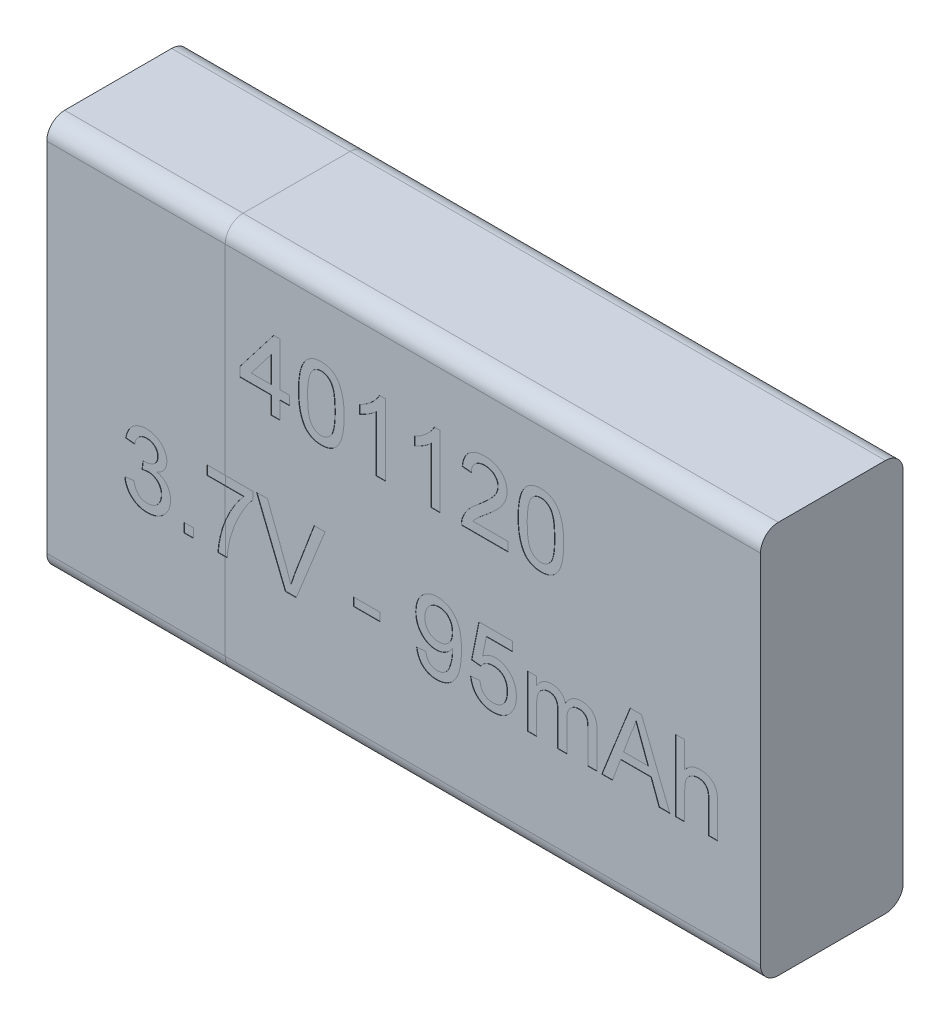
from build123d import *

# Parameters (mm, degrees)
SKETCH1_W           = 20
SKETCH1_H           = 11
BOSS_EXTRUDE1_DEPTH = 4
FILLET1_R           = 0.5
SKETCH5_W           = 0.256410257
SKETCH5_H           = 0.256410256
SKETCH5_W_2         = 0.743589744
SKETCH5_H_2         = 0.23076923
CUT_EXTRUDE1_DEPTH  = 0.01


with BuildPart() as part:
    # Sketch1 → Boss-Extrude1 (new body)
    with BuildSketch(Plane.XY):
        Rectangle(SKETCH1_W, SKETCH1_H)
    extrude(amount=BOSS_EXTRUDE1_DEPTH)

    # Fillet1
    fillet1_edges = [part.edges().sort_by_distance(p)[0] for p in [
        (0, 5.5, 4),
        (0, 5.5, 0),
        (0, -5.5, 0),
        (0, -5.5, 4),
    ]]
    fillet(fillet1_edges, radius=FILLET1_R)


with BuildPart() as body_2:
    # Split1: the piece on the far side of the plane
    add(part.part)
    split(bisect_by=Plane(origin=(-5, 0, 0), x_dir=(0, -1, 0), z_dir=(-1, 0, 0)), keep=Keep.BOTTOM)


with BuildPart() as part_1:
    add(part.part)

    # Split1
    split(bisect_by=Plane(origin=(-5, 0, 0), x_dir=(0, -1, 0), z_dir=(-1, 0, 0)), keep=Keep.TOP)


with BuildPart() as cut_extrude1_tool:
    # Sketch5 → Cut-Extrude1 (new body)
    # profile 1 of 16: a face of its own
    with BuildSketch(Plane.XY.offset(4)):
        Polygon((-3.717948718, 1.492817936), (-3.717948718, 1.979997423), (-4.58974359, 1.979997423), (-4.58974359, 2.236407679), (-3.641025641, 3.46717691), (-3.461538462, 3.46717691), (-3.461538462, 2.236407679), (-3.205128205, 2.236407679), (-3.205128205, 1.979997423), (-3.461538462, 1.979997423), (-3.461538462, 1.492817936), align=None)
        Polygon((-3.717948718, 2.236407679), (-3.717948718, 2.956760243), (-4.273237179, 2.236407679), align=None, mode=Mode.SUBTRACT)
    # profile 2 of 16: a face of its own
    with BuildSketch(Plane.XY.offset(4)):
        with BuildLine():
            add(Edge.make_bspline(
                [(-2.948717949, 2.479196141), (-2.948459615, 2.507777977), (-2.947953649, 2.563757757), (-2.944815304, 2.645666232), (-2.939336009, 2.723451319), (-2.931156929, 2.797045466), (-2.921471366, 2.866614788), (-2.908880073, 2.932060004), (-2.894713038, 2.99352795), (-2.877715138, 3.050954555), (-2.859040011, 3.104833585), (-2.837852483, 3.155078605), (-2.81401364, 3.201636343), (-2.788695013, 3.24498963), (-2.760563778, 3.284464143), (-2.731317878, 3.321167698), (-2.698831898, 3.353754234), (-2.664456674, 3.383062204), (-2.627686021, 3.408924779), (-2.588714493, 3.431241062), (-2.547692042, 3.450944732), (-2.503836825, 3.465777648), (-2.458059268, 3.47786962), (-2.410007, 3.486764621), (-2.359627067, 3.492008524), (-2.325199464, 3.492545084), (-2.307692308, 3.492817936)],
                knots=[0, 0, 0, 0, 1.514747001, 2.966751498, 4.343369068, 5.64627492, 6.890416844, 8.064737671, 9.177176366, 10.232018008, 11.237056675, 12.19799043, 13.119080079, 14.007588942, 14.855863561, 15.685992447, 16.491747269, 17.290132607, 18.077525251, 18.870243746, 19.668095604, 20.485086593, 21.319398728, 22.175900658, 23.072407314, 24, 24, 24, 24], degree=3))
            add(Edge.make_bspline(
                [(-2.307692308, 3.492817936), (-2.282007032, 3.492062807), (-2.231547278, 3.490579326), (-2.157875777, 3.478480324), (-2.088445136, 3.457783115), (-2.023300462, 3.429861689), (-1.963555395, 3.394396103), (-1.910200532, 3.35128228), (-1.863811391, 3.300972907), (-1.824894238, 3.242871834), (-1.790876762, 3.178581876), (-1.760656383, 3.107814477), (-1.733338039, 3.030648939), (-1.713952346, 2.961575011), (-1.700124548, 2.901947944), (-1.690971644, 2.852769227), (-1.683372899, 2.799705114), (-1.677551233, 2.742883982), (-1.672774694, 2.68236956), (-1.669085992, 2.618124172), (-1.667213597, 2.549987247), (-1.666852395, 2.503235545), (-1.666666667, 2.479196141)],
                knots=[0, 0, 0, 0, 1.134486744, 2.228744715, 3.287356444, 4.328707449, 5.352829806, 6.347195599, 7.349461267, 8.364207941, 9.428085653, 10.559314403, 11.761222316, 13.04268526, 13.726896727, 14.465273606, 15.252205015, 16.094778733, 16.988606776, 17.934225168, 18.937792761, 20, 20, 20, 20], degree=3))
            add(Edge.make_bspline(
                [(-1.666666667, 2.479196141), (-1.666929839, 2.450748558), (-1.667443998, 2.395170606), (-1.670498249, 2.313918899), (-1.676307711, 2.236720662), (-1.68345636, 2.163399057), (-1.694270768, 2.094149819), (-1.705923878, 2.028678724), (-1.720335897, 1.96728307), (-1.73715134, 1.909935949), (-1.756089347, 1.85633413), (-1.776857802, 1.806072519), (-1.799860861, 1.759185462), (-1.82578318, 1.71613027), (-1.853438697, 1.67633546), (-1.883029958, 1.63965175), (-1.915184334, 1.606607127), (-1.949869333, 1.577387065), (-1.986381809, 1.551065853), (-2.025448084, 1.528529241), (-2.06689717, 1.509858049), (-2.11045213, 1.493895107), (-2.156554892, 1.4821984), (-2.204841893, 1.473244754), (-2.255491049, 1.467972198), (-2.290051814, 1.467445664), (-2.307692308, 1.46717691)],
                knots=[0, 0, 0, 0, 1.508974709, 2.94807912, 4.311757619, 5.615040294, 6.854280449, 8.028314546, 9.141715822, 10.197470207, 11.196696834, 12.155719058, 13.080757287, 13.963948316, 14.818758719, 15.649605906, 16.461113142, 17.260189315, 18.052359509, 18.845763934, 19.647754795, 20.461145776, 21.303032214, 22.167241874, 23.064524267, 24, 24, 24, 24], degree=3))
            add(Edge.make_bspline(
                [(-2.307692308, 1.46717691), (-2.33082104, 1.467836658), (-2.375915702, 1.469122986), (-2.44177313, 1.47786279), (-2.503583839, 1.493245255), (-2.561869168, 1.51387531), (-2.615973972, 1.541469196), (-2.666156581, 1.575042546), (-2.713425378, 1.613814242), (-2.740636171, 1.64440422), (-2.754407051, 1.659885243)],
                knots=[0, 0, 0, 0, 1.10322584, 2.150986741, 3.161425019, 4.136713905, 5.093944212, 6.049774532, 7.013026876, 8, 8, 8, 8], degree=3))
            add(Edge.make_bspline(
                [(-2.754407051, 1.659885243), (-2.770257651, 1.682749967), (-2.802942267, 1.729898004), (-2.841196776, 1.810289782), (-2.875320475, 1.898789843), (-2.902101323, 1.997134546), (-2.923077402, 2.10454118), (-2.938227369, 2.221220499), (-2.946800758, 2.347122094), (-2.948064459, 2.434177627), (-2.948717949, 2.479196141)],
                knots=[0, 0, 0, 0, 0.779365345, 1.607084704, 2.489375761, 3.438383567, 4.461919411, 5.557722155, 6.737039282, 8, 8, 8, 8], degree=3))
        make_face()
        with BuildLine():
            add(Edge.make_bspline(
                [(-2.692307692, 2.479997423), (-2.692053097, 2.441530149), (-2.691565746, 2.367895277), (-2.68647411, 2.262695158), (-2.677709067, 2.167790291), (-2.666121109, 2.083312078), (-2.650820312, 2.009146245), (-2.631608351, 1.945481789), (-2.609951902, 1.891554594), (-2.583152457, 1.848033044), (-2.553810024, 1.812556632), (-2.523515968, 1.782045771), (-2.491557574, 1.756112237), (-2.458143366, 1.734488959), (-2.422754899, 1.718117233), (-2.38577914, 1.70625097), (-2.347208044, 1.699422118), (-2.320939374, 1.69844094), (-2.307692308, 1.697946141)],
                knots=[0, 0, 0, 0, 1.89448813, 3.626469325, 5.185477471, 6.587276848, 7.82441448, 8.910550357, 9.859733512, 10.6775885, 11.416198291, 12.123144072, 12.791880183, 13.439617036, 14.078171869, 14.70637855, 15.347637704, 16, 16, 16, 16], degree=3))
            add(Edge.make_bspline(
                [(-2.307692308, 1.697946141), (-2.294448558, 1.698451752), (-2.268186467, 1.699454368), (-2.229526248, 1.706132638), (-2.192694354, 1.718609768), (-2.157358651, 1.734923669), (-2.123701579, 1.756054088), (-2.091900141, 1.782085578), (-2.061446502, 1.812578323), (-2.032235875, 1.848467084), (-2.005640604, 1.892189848), (-1.983577907, 1.946073114), (-1.964665354, 2.009849065), (-1.949280599, 2.083977111), (-1.937644838, 2.168321758), (-1.92893279, 2.262963402), (-1.923807079, 2.368028162), (-1.923327771, 2.441529975), (-1.923076923, 2.479997423)],
                knots=[0, 0, 0, 0, 0.652509534, 1.29391342, 1.924290653, 2.562989607, 3.207355802, 3.876242846, 4.583348185, 5.32723334, 6.150888545, 7.094226006, 8.186903555, 9.424320409, 10.81992305, 12.379283064, 14.105084285, 16, 16, 16, 16], degree=3))
            add(Edge.make_bspline(
                [(-1.923076923, 2.479997423), (-1.923319739, 2.517664488), (-1.923784965, 2.589833159), (-1.929042875, 2.693006595), (-1.937282493, 2.786318522), (-1.94855298, 2.869854966), (-1.963531456, 2.943525237), (-1.981698305, 3.007486167), (-2.003346821, 3.061601352), (-2.029086829, 3.106414377), (-2.057740608, 3.143173215), (-2.087672197, 3.174991188), (-2.119629888, 3.202051337), (-2.154179876, 3.223759388), (-2.190208549, 3.241272636), (-2.228543754, 3.2533257), (-2.268808688, 3.260730725), (-2.296441989, 3.261604359), (-2.310496795, 3.262048705)],
                knots=[0, 0, 0, 0, 1.850066095, 3.544656626, 5.0727657, 6.45041401, 7.682899467, 8.762389858, 9.712573485, 10.538438529, 11.291566246, 11.996865408, 12.681389046, 13.341983376, 13.996294293, 14.643563182, 15.31009126, 16, 16, 16, 16], degree=3))
            add(Edge.make_bspline(
                [(-2.310496795, 3.262048705), (-2.323743029, 3.261701044), (-2.349862907, 3.2610155), (-2.388105828, 3.254471993), (-2.424348195, 3.24352979), (-2.459005228, 3.228707513), (-2.491211733, 3.208759657), (-2.52224494, 3.185469115), (-2.550651374, 3.157092189), (-2.567768842, 3.135878043), (-2.576522436, 3.125029474)],
                knots=[0, 0, 0, 0, 1.021318143, 2.013908504, 2.982026795, 3.937174072, 4.91255697, 5.897578595, 6.924855925, 8, 8, 8, 8], degree=3))
            add(Edge.make_bspline(
                [(-2.576522436, 3.125029474), (-2.58605243, 3.109096287), (-2.60617777, 3.075448749), (-2.628696855, 3.016967942), (-2.648589325, 2.950135512), (-2.664967423, 2.873923192), (-2.676815828, 2.788461717), (-2.686169685, 2.693850336), (-2.691028666, 2.589956958), (-2.691869587, 2.517661874), (-2.692307692, 2.479997423)],
                knots=[0, 0, 0, 0, 0.671104906, 1.417232262, 2.260109084, 3.195198885, 4.23592645, 5.382417421, 6.636286093, 8, 8, 8, 8], degree=3))
        make_face(mode=Mode.SUBTRACT)
    # profile 3 of 16: a face of its own
    with BuildSketch(Plane.XY.offset(4)):
        with BuildLine():
            Line((-0.512820513, 1.492817936), (-0.769230769, 1.492817936))
            Line((-0.769230769, 1.492817936), (-0.769230769, 3.051311526))
            add(Edge.make_bspline(
                [(-0.769230769, 3.051311526), (-0.783994894, 3.037073343), (-0.814680511, 3.007480842), (-0.866551304, 2.965600062), (-0.924445737, 2.923152117), (-0.987612016, 2.882333672), (-1.051999351, 2.843907509), (-1.114221421, 2.809349082), (-1.173239402, 2.780104268), (-1.212114865, 2.764113088), (-1.230769231, 2.756439731)],
                knots=[0, 0, 0, 0, 0.893362401, 1.856755847, 2.901947673, 4.020460078, 5.132200827, 6.168787962, 7.121294059, 8, 8, 8, 8], degree=3))
            Line((-1.230769231, 2.756439731), (-1.230769231, 2.992817936))
            add(Edge.make_bspline(
                [(-1.230769231, 2.992817936), (-1.198728429, 3.009319013), (-1.135577906, 3.041841659), (-1.046359873, 3.098012739), (-0.963065241, 3.158904502), (-0.887072868, 3.224503467), (-0.818950547, 3.291557385), (-0.761542878, 3.359217421), (-0.713507794, 3.425003453), (-0.689407682, 3.470881914), (-0.677884615, 3.492817936)],
                knots=[0, 0, 0, 0, 1.141258006, 2.249351951, 3.335817539, 4.406819942, 5.426913362, 6.360259544, 7.215985427, 8, 8, 8, 8], degree=3))
            Line((-0.677884615, 3.492817936), (-0.512820513, 3.492817936))
            Line((-0.512820513, 3.492817936), (-0.512820513, 1.492817936))
        make_face()
    # profile 4 of 16: a face of its own
    with BuildSketch(Plane.XY.offset(4)):
        with BuildLine():
            Line((1.025641026, 1.492817936), (0.769230769, 1.492817936))
            Line((0.769230769, 1.492817936), (0.769230769, 3.051311526))
            add(Edge.make_bspline(
                [(0.769230769, 3.051311526), (0.754466644, 3.037073343), (0.723781028, 3.007480842), (0.671910235, 2.965600062), (0.614015801, 2.923152117), (0.550849523, 2.882333672), (0.486462187, 2.843907509), (0.424240117, 2.809349082), (0.365222137, 2.780104268), (0.326346674, 2.764113088), (0.307692308, 2.756439731)],
                knots=[0, 0, 0, 0, 0.893362401, 1.856755847, 2.901947673, 4.020460078, 5.132200827, 6.168787962, 7.121294059, 8, 8, 8, 8], degree=3))
            Line((0.307692308, 2.756439731), (0.307692308, 2.992817936))
            add(Edge.make_bspline(
                [(0.307692308, 2.992817936), (0.339733109, 3.009319013), (0.402883632, 3.041841659), (0.492101666, 3.098012739), (0.575396297, 3.158904502), (0.651388671, 3.224503467), (0.719510992, 3.291557385), (0.77691866, 3.359217421), (0.824953745, 3.425003453), (0.849053856, 3.470881914), (0.860576923, 3.492817936)],
                knots=[0, 0, 0, 0, 1.141258006, 2.249351951, 3.335817539, 4.406819942, 5.426913362, 6.360259544, 7.215985427, 8, 8, 8, 8], degree=3))
            Line((0.860576923, 3.492817936), (1.025641026, 3.492817936))
            Line((1.025641026, 3.492817936), (1.025641026, 1.492817936))
        make_face()
    # profile 5 of 16: a face of its own
    with BuildSketch(Plane.XY.offset(4)):
        with BuildLine():
            Line((2.923076923, 1.749228192), (2.923076923, 1.492817936))
            Line((2.923076923, 1.492817936), (1.615384615, 1.492817936))
            add(Edge.make_bspline(
                [(1.615384615, 1.492817936), (1.615357843, 1.508057118), (1.615304389, 1.538484405), (1.620453176, 1.583484431), (1.628517208, 1.627887495), (1.637635205, 1.656361413), (1.642227564, 1.670702551)],
                knots=[0, 0, 0, 0, 1.01057331, 2.01775941, 3.001627217, 4, 4, 4, 4], degree=3))
            add(Edge.make_bspline(
                [(1.642227564, 1.670702551), (1.650712716, 1.694134259), (1.667989882, 1.741845076), (1.702993601, 1.810685122), (1.744166247, 1.879108838), (1.784253613, 1.934815402), (1.820964984, 1.979321053), (1.851752254, 2.014141573), (1.885870193, 2.04978448), (1.923291478, 2.086243261), (1.963655951, 2.123754046), (2.00701869, 2.162441932), (2.05389174, 2.201585927), (2.086614034, 2.227532195), (2.103365385, 2.240814731)],
                knots=[0, 0, 0, 0, 1.204657718, 2.452881516, 3.728232997, 5.065887527, 5.768225529, 6.518857853, 7.313994055, 8.154655305, 9.046094665, 9.979688118, 10.965752482, 12, 12, 12, 12], degree=3))
            add(Edge.make_bspline(
                [(2.103365385, 2.240814731), (2.129099596, 2.262474799), (2.178652453, 2.304182634), (2.248628853, 2.366073196), (2.312540903, 2.423542089), (2.369370878, 2.477596572), (2.419583586, 2.527712351), (2.463296929, 2.573775884), (2.500887029, 2.615643414), (2.531894985, 2.65483037), (2.558057348, 2.691833755), (2.580227641, 2.727928273), (2.598703638, 2.763744415), (2.614091672, 2.799168849), (2.626262299, 2.834353066), (2.634558312, 2.869399573), (2.640184382, 2.903960624), (2.640747274, 2.926957931), (2.641025641, 2.938330756)],
                knots=[0, 0, 0, 0, 1.782554561, 3.432421876, 4.950675607, 6.337395053, 7.588547463, 8.709982106, 9.702713005, 10.569305638, 11.356701089, 12.103210377, 12.812277205, 13.490692607, 14.148717897, 14.782152033, 15.397739362, 16, 16, 16, 16], degree=3))
            add(Edge.make_bspline(
                [(2.641025641, 2.938330756), (2.640747241, 2.949570887), (2.640201035, 2.971623411), (2.635018662, 3.003897142), (2.627804382, 3.034977517), (2.616141088, 3.06430502), (2.602258256, 3.092748152), (2.584450174, 3.119408147), (2.563849884, 3.14494944), (2.540264295, 3.168698628), (2.514503309, 3.190979157), (2.485719078, 3.20949969), (2.455802143, 3.226173688), (2.423720394, 3.239580538), (2.389525963, 3.249425428), (2.353467769, 3.256570282), (2.315551534, 3.261100503), (2.289676369, 3.261727846), (2.276442308, 3.262048705)],
                knots=[0, 0, 0, 0, 0.988194508, 1.938783882, 2.870742509, 3.789494954, 4.709148727, 5.651055405, 6.603531303, 7.592354411, 8.592907906, 9.593461401, 10.59787167, 11.603930315, 12.645063138, 13.723588815, 14.835711238, 16, 16, 16, 16], degree=3))
            add(Edge.make_bspline(
                [(2.276442308, 3.262048705), (2.262540295, 3.261729435), (2.235333034, 3.261104599), (2.195563304, 3.256556311), (2.15780884, 3.249607142), (2.122159754, 3.238982457), (2.088659437, 3.225597963), (2.057444328, 3.20875045), (2.028014543, 3.189732655), (2.001296939, 3.16721702), (1.97713656, 3.142251773), (1.955687768, 3.115072172), (1.938113706, 3.085153706), (1.923600321, 3.053154214), (1.911930345, 3.018973104), (1.903458338, 2.982349067), (1.898839344, 2.943387849), (1.897910503, 2.916707218), (1.897435897, 2.903074346)],
                knots=[0, 0, 0, 0, 1.131143733, 2.213731411, 3.253917892, 4.251203413, 5.236093891, 6.184197493, 7.13373276, 8.082770301, 9.020476205, 9.957489029, 10.893177274, 11.836722509, 12.812818608, 13.827831385, 14.890097571, 16, 16, 16, 16], degree=3))
            Line((1.897435897, 2.903074346), (1.641025641, 2.928715372))
            add(Edge.make_bspline(
                [(1.641025641, 2.928715372), (1.643649082, 2.951062152), (1.648752761, 2.99453589), (1.661465329, 3.057500276), (1.679312625, 3.116075204), (1.70066842, 3.171077331), (1.727439921, 3.221570356), (1.757702799, 3.268598669), (1.793396467, 3.31067073), (1.8328285, 3.34911271), (1.876430919, 3.38299021), (1.923794148, 3.41258691), (1.97489652, 3.437342722), (2.029453414, 3.457839502), (2.087590078, 3.473390925), (2.149224268, 3.484542762), (2.214455103, 3.491416883), (2.259197728, 3.492344254), (2.282051282, 3.492817936)],
                knots=[0, 0, 0, 0, 1.130804643, 2.199883102, 3.223565206, 4.205909148, 5.160801384, 6.091796021, 7.01151579, 7.927798993, 8.855738875, 9.7815393, 10.730299821, 11.705391175, 12.706931101, 13.751121791, 14.851322166, 16, 16, 16, 16], degree=3))
            add(Edge.make_bspline(
                [(2.282051282, 3.492817936), (2.305178381, 3.49242191), (2.350230106, 3.491650451), (2.41587771, 3.483756869), (2.477818039, 3.471462688), (2.536278164, 3.454328363), (2.590912695, 3.431860153), (2.641763658, 3.404409075), (2.689065517, 3.372242905), (2.732027954, 3.334975509), (2.770768307, 3.294291903), (2.804718513, 3.250873726), (2.83310252, 3.204906461), (2.85726974, 3.157016672), (2.875195459, 3.10619248), (2.887801155, 3.053124851), (2.896367091, 2.997768434), (2.897074892, 2.959998625), (2.897435897, 2.940734602)],
                knots=[0, 0, 0, 0, 1.195390245, 2.328627238, 3.413424916, 4.457841177, 5.473507151, 6.462241215, 7.441013641, 8.425227782, 9.397253344, 10.342087291, 11.269524934, 12.186751184, 13.110685745, 14.048630397, 15.004728144, 16, 16, 16, 16], degree=3))
            add(Edge.make_bspline(
                [(2.897435897, 2.940734602), (2.896884648, 2.920943002), (2.895780933, 2.881316124), (2.88716629, 2.822085629), (2.872426541, 2.763497916), (2.852885566, 2.704839938), (2.826188529, 2.645878884), (2.792461355, 2.585801385), (2.75061911, 2.52438552), (2.710378602, 2.472175211), (2.67292122, 2.428409806), (2.639718791, 2.392388321), (2.601305502, 2.354117902), (2.559122379, 2.312273155), (2.511448993, 2.268339239), (2.45965511, 2.221000527), (2.402606937, 2.171502794), (2.363004387, 2.137688319), (2.342548077, 2.120221782)],
                knots=[0, 0, 0, 0, 0.927118007, 1.856282007, 2.79721255, 3.754929441, 4.749232485, 5.824981375, 6.979078785, 8.228161913, 8.911614355, 9.677694854, 10.522803217, 11.452009355, 12.461436787, 13.560019032, 14.739651695, 16, 16, 16, 16], degree=3))
            add(Edge.make_bspline(
                [(2.342548077, 2.120221782), (2.325030337, 2.105960474), (2.291626704, 2.078766356), (2.244103565, 2.039342315), (2.201537287, 2.003191537), (2.162932464, 1.971493192), (2.129695059, 1.942714072), (2.10065433, 1.918114576), (2.076865344, 1.89645785), (2.04063893, 1.863560847), (1.994755086, 1.816669494), (1.960945906, 1.771106476), (1.944711538, 1.749228192)],
                knots=[0, 0, 0, 0, 1.241996727, 2.368296581, 3.394949853, 4.3125351, 5.114548721, 5.812230366, 6.404953749, 6.883082049, 8.503329734, 10, 10, 10, 10], degree=3))
            Line((1.944711538, 1.749228192), (2.923076923, 1.749228192))
        make_face()
    # profile 6 of 16: a face of its own
    with BuildSketch(Plane.XY.offset(4)):
        with BuildLine():
            add(Edge.make_bspline(
                [(3.205128205, 2.479196141), (3.205386539, 2.507777977), (3.205892505, 2.563757757), (3.20903085, 2.645666232), (3.214510145, 2.723451319), (3.222689225, 2.797045466), (3.232374788, 2.866614788), (3.244966081, 2.932060004), (3.259133116, 2.99352795), (3.276131016, 3.050954555), (3.294806143, 3.104833585), (3.315993671, 3.155078605), (3.339832514, 3.201636343), (3.365151141, 3.24498963), (3.393282376, 3.284464143), (3.422528276, 3.321167698), (3.455014256, 3.353754234), (3.48938948, 3.383062204), (3.526160133, 3.408924779), (3.565131661, 3.431241062), (3.606154112, 3.450944732), (3.650009329, 3.465777648), (3.695786886, 3.47786962), (3.743839154, 3.486764621), (3.794219087, 3.492008524), (3.82864669, 3.492545084), (3.846153846, 3.492817936)],
                knots=[0, 0, 0, 0, 1.514747001, 2.966751498, 4.343369068, 5.64627492, 6.890416844, 8.064737671, 9.177176366, 10.232018008, 11.237056675, 12.19799043, 13.119080079, 14.007588942, 14.855863561, 15.685992447, 16.491747269, 17.290132607, 18.077525251, 18.870243746, 19.668095604, 20.485086593, 21.319398728, 22.175900658, 23.072407314, 24, 24, 24, 24], degree=3))
            add(Edge.make_bspline(
                [(3.846153846, 3.492817936), (3.871839122, 3.492062807), (3.922298875, 3.490579326), (3.995970377, 3.478480324), (4.065401018, 3.457783115), (4.130545692, 3.429861689), (4.190290759, 3.394396103), (4.243645622, 3.35128228), (4.290034763, 3.300972907), (4.328951915, 3.242871834), (4.362969392, 3.178581876), (4.39318977, 3.107814477), (4.420508115, 3.030648939), (4.439893807, 2.961575011), (4.453721606, 2.901947944), (4.46287451, 2.852769227), (4.470473255, 2.799705114), (4.47629492, 2.742883982), (4.48107146, 2.68236956), (4.484760162, 2.618124172), (4.486632556, 2.549987247), (4.486993759, 2.503235545), (4.487179487, 2.479196141)],
                knots=[0, 0, 0, 0, 1.134486744, 2.228744715, 3.287356444, 4.328707449, 5.352829806, 6.347195599, 7.349461267, 8.364207941, 9.428085653, 10.559314403, 11.761222316, 13.04268526, 13.726896727, 14.465273606, 15.252205015, 16.094778733, 16.988606776, 17.934225168, 18.937792761, 20, 20, 20, 20], degree=3))
            add(Edge.make_bspline(
                [(4.487179487, 2.479196141), (4.486916315, 2.450748558), (4.486402156, 2.395170606), (4.483347904, 2.313918899), (4.477538443, 2.236720662), (4.470389794, 2.163399057), (4.459575386, 2.094149819), (4.447922276, 2.028678724), (4.433510257, 1.96728307), (4.416694814, 1.909935949), (4.397756807, 1.85633413), (4.376988351, 1.806072519), (4.353985293, 1.759185462), (4.328062974, 1.71613027), (4.300407457, 1.67633546), (4.270816195, 1.63965175), (4.23866182, 1.606607127), (4.203976821, 1.577387065), (4.167464344, 1.551065853), (4.12839807, 1.528529241), (4.086948984, 1.509858049), (4.043394024, 1.493895107), (3.997291262, 1.4821984), (3.949004261, 1.473244754), (3.898355105, 1.467972198), (3.863794339, 1.467445664), (3.846153846, 1.46717691)],
                knots=[0, 0, 0, 0, 1.508974709, 2.94807912, 4.311757619, 5.615040294, 6.854280449, 8.028314546, 9.141715822, 10.197470207, 11.196696834, 12.155719058, 13.080757287, 13.963948316, 14.818758719, 15.649605906, 16.461113142, 17.260189315, 18.052359509, 18.845763934, 19.647754795, 20.461145776, 21.303032214, 22.167241874, 23.064524267, 24, 24, 24, 24], degree=3))
            add(Edge.make_bspline(
                [(3.846153846, 1.46717691), (3.823025114, 1.467836658), (3.777930452, 1.469122986), (3.712073024, 1.47786279), (3.650262314, 1.493245255), (3.591976986, 1.51387531), (3.537872182, 1.541469196), (3.487689573, 1.575042546), (3.440420776, 1.613814242), (3.413209983, 1.64440422), (3.399439103, 1.659885243)],
                knots=[0, 0, 0, 0, 1.10322584, 2.150986741, 3.161425019, 4.136713905, 5.093944212, 6.049774532, 7.013026876, 8, 8, 8, 8], degree=3))
            add(Edge.make_bspline(
                [(3.399439103, 1.659885243), (3.383588503, 1.682749967), (3.350903887, 1.729898004), (3.312649378, 1.810289782), (3.278525679, 1.898789843), (3.251744831, 1.997134546), (3.230768752, 2.10454118), (3.215618785, 2.221220499), (3.207045396, 2.347122094), (3.205781695, 2.434177627), (3.205128205, 2.479196141)],
                knots=[0, 0, 0, 0, 0.779365345, 1.607084704, 2.489375761, 3.438383567, 4.461919411, 5.557722155, 6.737039282, 8, 8, 8, 8], degree=3))
        make_face()
        with BuildLine():
            add(Edge.make_bspline(
                [(3.461538462, 2.479997423), (3.461793057, 2.441530149), (3.462280408, 2.367895277), (3.467372044, 2.262695158), (3.476137086, 2.167790291), (3.487725045, 2.083312078), (3.503025842, 2.009146245), (3.522237803, 1.945481789), (3.543894252, 1.891554594), (3.570693697, 1.848033044), (3.600036129, 1.812556632), (3.630330186, 1.782045771), (3.66228858, 1.756112237), (3.695702788, 1.734488959), (3.731091255, 1.718117233), (3.768067014, 1.70625097), (3.80663811, 1.699422118), (3.83290678, 1.69844094), (3.846153846, 1.697946141)],
                knots=[0, 0, 0, 0, 1.89448813, 3.626469325, 5.185477471, 6.587276848, 7.82441448, 8.910550357, 9.859733512, 10.6775885, 11.416198291, 12.123144072, 12.791880183, 13.439617036, 14.078171869, 14.70637855, 15.347637704, 16, 16, 16, 16], degree=3))
            add(Edge.make_bspline(
                [(3.846153846, 1.697946141), (3.859397596, 1.698451752), (3.885659687, 1.699454368), (3.924319905, 1.706132638), (3.9611518, 1.718609768), (3.996487503, 1.734923669), (4.030144575, 1.756054088), (4.061946013, 1.782085578), (4.092399652, 1.812578323), (4.121610279, 1.848467084), (4.14820555, 1.892189848), (4.170268247, 1.946073114), (4.1891808, 2.009849065), (4.204565555, 2.083977111), (4.216201316, 2.168321758), (4.224913364, 2.262963402), (4.230039075, 2.368028162), (4.230518383, 2.441529975), (4.230769231, 2.479997423)],
                knots=[0, 0, 0, 0, 0.652509534, 1.29391342, 1.924290653, 2.562989607, 3.207355802, 3.876242846, 4.583348185, 5.32723334, 6.150888545, 7.094226006, 8.186903555, 9.424320409, 10.81992305, 12.379283064, 14.105084285, 16, 16, 16, 16], degree=3))
            add(Edge.make_bspline(
                [(4.230769231, 2.479997423), (4.230526415, 2.517664488), (4.230061188, 2.589833159), (4.224803278, 2.693006595), (4.216563661, 2.786318522), (4.205293173, 2.869854966), (4.190314697, 2.943525237), (4.172147849, 3.007486167), (4.150499333, 3.061601352), (4.124759325, 3.106414377), (4.096105546, 3.143173215), (4.066173957, 3.174991188), (4.034216266, 3.202051337), (3.999666278, 3.223759388), (3.963637605, 3.241272636), (3.9253024, 3.2533257), (3.885037466, 3.260730725), (3.857404165, 3.261604359), (3.843349359, 3.262048705)],
                knots=[0, 0, 0, 0, 1.850066095, 3.544656626, 5.0727657, 6.45041401, 7.682899467, 8.762389858, 9.712573485, 10.538438529, 11.291566246, 11.996865408, 12.681389046, 13.341983376, 13.996294293, 14.643563182, 15.31009126, 16, 16, 16, 16], degree=3))
            add(Edge.make_bspline(
                [(3.843349359, 3.262048705), (3.830103124, 3.261701044), (3.803983247, 3.2610155), (3.765740326, 3.254471993), (3.729497959, 3.24352979), (3.694840926, 3.228707513), (3.662634421, 3.208759657), (3.631601214, 3.185469115), (3.60319478, 3.157092189), (3.586077312, 3.135878043), (3.577323718, 3.125029474)],
                knots=[0, 0, 0, 0, 1.021318143, 2.013908504, 2.982026795, 3.937174072, 4.91255697, 5.897578595, 6.924855925, 8, 8, 8, 8], degree=3))
            add(Edge.make_bspline(
                [(3.577323718, 3.125029474), (3.567793724, 3.109096287), (3.547668384, 3.075448749), (3.525149299, 3.016967942), (3.505256829, 2.950135512), (3.488878731, 2.873923192), (3.477030326, 2.788461717), (3.467676469, 2.693850336), (3.462817488, 2.589956958), (3.461976567, 2.517661874), (3.461538462, 2.479997423)],
                knots=[0, 0, 0, 0, 0.671104906, 1.417232262, 2.260109084, 3.195198885, 4.23592645, 5.382417421, 6.636286093, 8, 8, 8, 8], degree=3))
        make_face(mode=Mode.SUBTRACT)
    # profile 7 of 16: a face of its own
    with BuildSketch(Plane.XY.offset(4)):
        with BuildLine():
            Line((-7.814716201, -2.045643603), (-7.558305945, -2.020002577))
            add(Edge.make_bspline(
                [(-7.558305945, -2.020002577), (-7.554887689, -2.035409224), (-7.548273618, -2.065219942), (-7.535547336, -2.107926894), (-7.522105589, -2.147568495), (-7.505441933, -2.183258057), (-7.489181826, -2.216455137), (-7.470073738, -2.245788062), (-7.449656376, -2.272022167), (-7.42755229, -2.295060038), (-7.403506771, -2.314898459), (-7.377840398, -2.332258147), (-7.350010352, -2.346755825), (-7.320229705, -2.358234452), (-7.288749284, -2.367526498), (-7.255398007, -2.374349479), (-7.219999518, -2.378414014), (-7.195736727, -2.378786233), (-7.183305945, -2.378976936)],
                knots=[0, 0, 0, 0, 1.321063709, 2.556160278, 3.730472002, 4.821700466, 5.852032229, 6.822994757, 7.746964065, 8.632786469, 9.490489437, 10.352773447, 11.223141997, 12.11199479, 13.021433979, 13.96892724, 14.959401504, 16, 16, 16, 16], degree=3))
            add(Edge.make_bspline(
                [(-7.183305945, -2.378976936), (-7.168725078, -2.378769048), (-7.140248621, -2.378363043), (-7.098753727, -2.372271413), (-7.059264017, -2.363907024), (-7.022342905, -2.350791184), (-6.987476287, -2.334761202), (-6.954862797, -2.314951545), (-6.924279199, -2.291690051), (-6.896328732, -2.264818492), (-6.871332699, -2.235258921), (-6.84907022, -2.20403647), (-6.83066214, -2.170884727), (-6.815146901, -2.136270644), (-6.803694626, -2.099634874), (-6.795310636, -2.061434247), (-6.789831655, -2.021496002), (-6.789330796, -1.994246355), (-6.789075176, -1.980339116)],
                knots=[0, 0, 0, 0, 1.111377895, 2.170522867, 3.193923215, 4.186422864, 5.152846954, 6.117443035, 7.091571248, 8.078879332, 9.069127402, 10.041602243, 10.999610288, 11.957618333, 12.930786866, 13.922135183, 14.939532534, 16, 16, 16, 16], degree=3))
            add(Edge.make_bspline(
                [(-6.789075176, -1.980339116), (-6.789375605, -1.967104253), (-6.78996337, -1.941211299), (-6.794795279, -1.903205999), (-6.803226853, -1.867128718), (-6.814915029, -1.832770665), (-6.82985012, -1.800182278), (-6.84780166, -1.769094083), (-6.869757864, -1.740187379), (-6.894471508, -1.713151683), (-6.921426883, -1.68824405), (-6.950925402, -1.667056902), (-6.981968929, -1.648771703), (-7.014927434, -1.63400712), (-7.049664071, -1.622288386), (-7.086145725, -1.613865902), (-7.124547793, -1.609031897), (-7.150706805, -1.608444028), (-7.164075176, -1.608143603)],
                knots=[0, 0, 0, 0, 1.072815875, 2.098878726, 3.09954706, 4.07199174, 5.036203424, 6.001873089, 6.97636515, 7.972747947, 8.969130744, 9.945905975, 10.911575641, 11.885646534, 12.868345115, 13.879560892, 14.916365174, 16, 16, 16, 16], degree=3))
            add(Edge.make_bspline(
                [(-7.164075176, -1.608143603), (-7.175845214, -1.608455428), (-7.20082398, -1.609117194), (-7.240248831, -1.614960339), (-7.283918531, -1.623142112), (-7.314095541, -1.631171308), (-7.32994056, -1.635387192)],
                knots=[0, 0, 0, 0, 0.837610211, 1.777604146, 2.833088267, 4, 4, 4, 4], degree=3))
            Line((-7.32994056, -1.635387192), (-7.303498253, -1.404617962))
            add(Edge.make_bspline(
                [(-7.303498253, -1.404617962), (-7.296560409, -1.405376078), (-7.284303629, -1.40671541), (-7.271985039, -1.407208478), (-7.266639278, -1.407422449)],
                knots=[0, 0, 0, 0, 1.132082448, 2, 2, 2, 2], degree=3))
            add(Edge.make_bspline(
                [(-7.266639278, -1.407422449), (-7.243058026, -1.406522126), (-7.196799021, -1.404755975), (-7.129362359, -1.390080739), (-7.065452182, -1.366975055), (-7.016077442, -1.339406621), (-6.979462803, -1.313477012), (-6.956374348, -1.290097791), (-6.935558915, -1.265287714), (-6.9200289, -1.236829658), (-6.906611926, -1.206592286), (-6.898303495, -1.173384468), (-6.892244307, -1.138013399), (-6.891844576, -1.113514436), (-6.891639278, -1.100932064)],
                knots=[0, 0, 0, 0, 1.557468908, 3.055264441, 4.54122591, 6.035034992, 6.780215604, 7.498173296, 8.201377046, 8.913174237, 9.633083494, 10.382644491, 11.169345745, 12, 12, 12, 12], degree=3))
            add(Edge.make_bspline(
                [(-6.891639278, -1.100932064), (-6.891828753, -1.090768858), (-6.892199311, -1.070892495), (-6.896327499, -1.041751648), (-6.903155014, -1.014139797), (-6.91238308, -0.987762125), (-6.924477376, -0.962756873), (-6.939475254, -0.939154652), (-6.956610838, -0.916476672), (-6.976838788, -0.895894783), (-6.998501168, -0.876571446), (-7.022387915, -0.860297234), (-7.047362199, -0.845839988), (-7.074304807, -0.834915322), (-7.102550587, -0.825933466), (-7.132340991, -0.819639344), (-7.163686889, -0.81541242), (-7.185161083, -0.815056245), (-7.196126458, -0.814874372)],
                knots=[0, 0, 0, 0, 1.041493611, 2.036867705, 3.009952345, 3.954088258, 4.897230656, 5.850851638, 6.817653571, 7.805463921, 8.805067469, 9.788883576, 10.763797054, 11.758134544, 12.762883247, 13.799594994, 14.876406454, 16, 16, 16, 16], degree=3))
            add(Edge.make_bspline(
                [(-7.196126458, -0.814874372), (-7.217585419, -0.815711092), (-7.259025855, -0.817326923), (-7.318356779, -0.832276711), (-7.37212131, -0.856467412), (-7.411925976, -0.884836352), (-7.440190789, -0.911958663), (-7.459497153, -0.934947949), (-7.476765602, -0.960334826), (-7.492045077, -0.988110243), (-7.505129149, -1.018385905), (-7.516924076, -1.050786739), (-7.526054445, -1.085831485), (-7.530424074, -1.110114038), (-7.532664919, -1.12256668)],
                knots=[0, 0, 0, 0, 1.533565899, 2.961543033, 4.347411787, 5.731829577, 6.434842101, 7.147085226, 7.87612511, 8.629021686, 9.412189982, 10.234506416, 11.094615066, 12, 12, 12, 12], degree=3))
            Line((-7.532664919, -1.12256668), (-7.789075176, -1.096925654))
            add(Edge.make_bspline(
                [(-7.789075176, -1.096925654), (-7.785064154, -1.077099734), (-7.777196219, -1.038209631), (-7.761166673, -0.982041725), (-7.74161884, -0.929316057), (-7.718148382, -0.880274361), (-7.691864118, -0.834329726), (-7.661543312, -0.792027127), (-7.627896836, -0.753115067), (-7.590864925, -0.717712236), (-7.55095031, -0.686093547), (-7.508354029, -0.65881828), (-7.463425654, -0.63569856), (-7.416123121, -0.617059975), (-7.366483881, -0.601903982), (-7.314366714, -0.591863099), (-7.26000752, -0.585070947), (-7.222991125, -0.584431037), (-7.204139278, -0.584105141)],
                knots=[0, 0, 0, 0, 1.136581168, 2.229493434, 3.279335563, 4.293305329, 5.282068175, 6.250623624, 7.213783178, 8.169396253, 9.125981663, 10.071280146, 11.007896369, 11.961295906, 12.925420184, 13.920544621, 14.940967302, 16, 16, 16, 16], degree=3))
            add(Edge.make_bspline(
                [(-7.204139278, -0.584105141), (-7.178043835, -0.584951352), (-7.126731757, -0.586615277), (-7.051366272, -0.599830365), (-6.979279582, -0.62151659), (-6.911051764, -0.651577565), (-6.847856642, -0.688311282), (-6.791934168, -0.732334406), (-6.74403195, -0.782885345), (-6.705080382, -0.839411431), (-6.674236204, -0.899594821), (-6.651412439, -0.96206779), (-6.637774897, -1.026758422), (-6.636079373, -1.070553963), (-6.635229022, -1.092518603)],
                knots=[0, 0, 0, 0, 1.104647871, 2.172094857, 3.229560912, 4.285649672, 5.322588163, 6.317201348, 7.289435229, 8.260615662, 9.214246199, 10.146367077, 11.070353327, 12, 12, 12, 12], degree=3))
            add(Edge.make_bspline(
                [(-6.635229022, -1.092518603), (-6.636091108, -1.113281709), (-6.637793255, -1.154277468), (-6.650897779, -1.21422053), (-6.673041818, -1.271009841), (-6.702972244, -1.324844649), (-6.741784663, -1.374560732), (-6.789372469, -1.418862293), (-6.844974382, -1.458173233), (-6.886643313, -1.478634142), (-6.90806556, -1.489153218)],
                knots=[0, 0, 0, 0, 0.975609618, 1.926294443, 2.868398979, 3.832526731, 4.812148358, 5.820404151, 6.879456693, 8, 8, 8, 8], degree=3))
            add(Edge.make_bspline(
                [(-6.90806556, -1.489153218), (-6.893703373, -1.492779386), (-6.865572039, -1.499881991), (-6.825169065, -1.514598389), (-6.787185733, -1.531827588), (-6.75111651, -1.551341684), (-6.718008553, -1.574420265), (-6.68672066, -1.599654077), (-6.658435587, -1.628258398), (-6.632333863, -1.65921372), (-6.608584499, -1.692196089), (-6.588599176, -1.727847087), (-6.571352424, -1.765229512), (-6.556646033, -1.804614497), (-6.546078053, -1.846305731), (-6.538521614, -1.88998023), (-6.533534981, -1.935486256), (-6.532957782, -1.96657055), (-6.532664919, -1.982342321)],
                knots=[0, 0, 0, 0, 1.053251915, 2.063013066, 3.05373318, 4.018979697, 4.975584284, 5.920798056, 6.874756953, 7.832116109, 8.799604348, 9.761196922, 10.734637845, 11.72654167, 12.747371341, 13.789206138, 14.878271633, 16, 16, 16, 16], degree=3))
            add(Edge.make_bspline(
                [(-6.532664919, -1.982342321), (-6.533152935, -2.003874581), (-6.534112043, -2.046192383), (-6.543204415, -2.108358198), (-6.558063391, -2.167921405), (-6.578626221, -2.225084272), (-6.60468258, -2.280080089), (-6.637379014, -2.332132772), (-6.675746473, -2.381665439), (-6.719185137, -2.428203833), (-6.766776351, -2.470974049), (-6.818458588, -2.508008967), (-6.87320932, -2.539459603), (-6.931117644, -2.565107441), (-6.992030047, -2.585257773), (-7.056007124, -2.599702175), (-7.123246851, -2.608191299), (-7.169125526, -2.609221057), (-7.192520689, -2.609746167)],
                knots=[0, 0, 0, 0, 1.016055063, 1.996874249, 2.958724482, 3.910019225, 4.860394196, 5.826121543, 6.806008102, 7.814207964, 8.82789325, 9.821757317, 10.810247154, 11.803791187, 12.806673825, 13.834534493, 14.895752369, 16, 16, 16, 16], degree=3))
            add(Edge.make_bspline(
                [(-7.192520689, -2.609746167), (-7.213515906, -2.609350702), (-7.254848354, -2.608572167), (-7.315350525, -2.600461154), (-7.373314749, -2.588950695), (-7.428282679, -2.571205939), (-7.480892816, -2.549566497), (-7.530254134, -2.521882095), (-7.577254188, -2.490101474), (-7.621010611, -2.453316653), (-7.6612804, -2.412715827), (-7.697205868, -2.368899515), (-7.728055313, -2.321965004), (-7.755255145, -2.272614524), (-7.777239644, -2.219917792), (-7.794358057, -2.164327244), (-7.807411077, -2.106049195), (-7.812254665, -2.065997882), (-7.814716201, -2.045643603)],
                knots=[0, 0, 0, 0, 1.08471039, 2.135426191, 3.150939737, 4.135689946, 5.116584603, 6.086901885, 7.055842759, 8.045878862, 9.036901429, 10.008421467, 10.96965771, 11.936653536, 12.917548193, 13.915472582, 14.940632654, 16, 16, 16, 16], degree=3))
        make_face()
    # profile 8 of 16: a face of its own
    with BuildSketch(Plane.XY.offset(4)):
        with Locations((-6.019844407, -2.455900013)):
            Rectangle(SKETCH5_W, SKETCH5_H)
    # profile 9 of 16: a face of its own
    with BuildSketch(Plane.XY.offset(4)):
        with BuildLine():
            Line((-5.507023894, -0.866156423), (-5.507023894, -0.609746167))
            Line((-5.507023894, -0.609746167), (-4.224972612, -0.609746167))
            Line((-4.224972612, -0.609746167), (-4.224972612, -0.817278218))
            add(Edge.make_bspline(
                [(-4.224972612, -0.817278218), (-4.240065701, -0.834928324), (-4.270925767, -0.871016591), (-4.315632875, -0.928499405), (-4.36057229, -0.989698988), (-4.404954108, -1.055203834), (-4.449441483, -1.12453589), (-4.493855368, -1.197916589), (-4.538377076, -1.275167197), (-4.596776229, -1.383333106), (-4.666449431, -1.521812739), (-4.738846503, -1.692444567), (-4.803118371, -1.864777098), (-4.837320942, -1.981979783), (-4.854379663, -2.040435269)],
                knots=[0, 0, 0, 0, 0.603281671, 1.233499104, 1.891379699, 2.575603978, 3.288773649, 4.031381703, 4.80386477, 5.604951941, 7.224880277, 8.828980706, 10.418436603, 12, 12, 12, 12], degree=3))
            add(Edge.make_bspline(
                [(-4.854379663, -2.040435269), (-4.865442967, -2.082651868), (-4.887949837, -2.168536108), (-4.912587927, -2.301903456), (-4.931636824, -2.440959004), (-4.939116974, -2.535846163), (-4.94292133, -2.584105141)],
                knots=[0, 0, 0, 0, 0.948866074, 1.930345965, 2.947387709, 4, 4, 4, 4], degree=3))
            Line((-4.94292133, -2.584105141), (-5.199331586, -2.584105141))
            add(Edge.make_bspline(
                [(-5.199331586, -2.584105141), (-5.198716571, -2.564196154), (-5.197451828, -2.523254495), (-5.191859033, -2.460343278), (-5.184409943, -2.394305859), (-5.173888734, -2.325365327), (-5.160515414, -2.253381741), (-5.144579352, -2.178278855), (-5.125547032, -2.100211998), (-5.097399317, -1.991977421), (-5.055595384, -1.855881373), (-4.994731885, -1.694960276), (-4.924737215, -1.536800589), (-4.857932728, -1.408541462), (-4.800964845, -1.308663489), (-4.757734119, -1.236194317), (-4.713274053, -1.167139221), (-4.6684089, -1.101001439), (-4.623130883, -1.037725272), (-4.576517666, -0.977902182), (-4.529943568, -0.920330328), (-4.497427015, -0.884055138), (-4.481382868, -0.866156423)],
                knots=[0, 0, 0, 0, 0.630312875, 1.296201307, 1.998242258, 2.7335219, 3.502880474, 4.315318118, 5.163159648, 6.045885937, 7.85484959, 9.666009448, 11.488277305, 13.325849397, 14.240191093, 15.127469759, 15.996293014, 16.839220888, 17.656853801, 18.458354243, 19.239329216, 20, 20, 20, 20], degree=3))
            Line((-4.481382868, -0.866156423), (-5.507023894, -0.866156423))
        make_face()
    # profile 10 of 16: a face of its own
    with BuildSketch(Plane.XY.offset(4)):
        with BuildLine():
            Line((-3.31431556, -2.584105141), (-4.120405304, -0.584105141))
            Line((-4.120405304, -0.584105141), (-3.814716201, -0.584105141))
            Line((-3.814716201, -0.584105141), (-3.270645689, -2.017598731))
            add(Edge.make_bspline(
                [(-3.270645689, -2.017598731), (-3.259998768, -2.045875007), (-3.239171195, -2.101189235), (-3.210127129, -2.183271757), (-3.184163482, -2.26264974), (-3.168510328, -2.314975349), (-3.160870047, -2.340515398)],
                knots=[0, 0, 0, 0, 1.062747156, 2.078952616, 3.062339733, 4, 4, 4, 4], degree=3))
            add(Edge.make_bspline(
                [(-3.160870047, -2.340515398), (-3.144605016, -2.286507123), (-3.111841753, -2.177716227), (-3.072238766, -2.071223892), (-3.05229633, -2.017598731)],
                knots=[0, 0, 0, 0, 0.992882236, 2, 2, 2, 2], degree=3))
            Line((-3.05229633, -2.017598731), (-2.507023894, -0.584105141))
            Line((-2.507023894, -0.584105141), (-2.201735432, -0.584105141))
            Line((-2.201735432, -0.584105141), (-3.009027099, -2.584105141))
            Line((-3.009027099, -2.584105141), (-3.31431556, -2.584105141))
        make_face()
    # profile 11 of 16: a face of its own
    with BuildSketch(Plane.XY.offset(4)):
        with Locations((-1.032664919, -1.878976936)):
            Rectangle(SKETCH5_W_2, SKETCH5_H_2)
    # profile 12 of 16: a face of its own
    with BuildSketch(Plane.XY.offset(4)):
        with BuildLine():
            Line((0.364770978, -2.096925654), (0.621181235, -2.071284628))
            add(Edge.make_bspline(
                [(0.621181235, -2.071284628), (0.623499336, -2.084422081), (0.627980423, -2.10981789), (0.638092825, -2.146011271), (0.648349281, -2.179758093), (0.661588983, -2.210306559), (0.675377169, -2.238486449), (0.69099191, -2.264015379), (0.70871141, -2.286380608), (0.73373367, -2.31258867), (0.769236614, -2.339937228), (0.818448507, -2.362090626), (0.872586211, -2.376985919), (0.910738385, -2.378298093), (0.930476106, -2.378976936)],
                knots=[0, 0, 0, 0, 0.994516507, 1.922484754, 2.80151264, 3.623050913, 4.402748861, 5.140924173, 5.850441436, 6.526872911, 7.841975818, 9.161260782, 10.53140107, 12, 12, 12, 12], degree=3))
            add(Edge.make_bspline(
                [(0.930476106, -2.378976936), (0.947746804, -2.378355003), (0.981738214, -2.377130941), (1.031298816, -2.367641918), (1.078430178, -2.352440702), (1.122311875, -2.33063014), (1.162784198, -2.304087295), (1.198135409, -2.272549049), (1.228837554, -2.237373714), (1.254053552, -2.196844979), (1.275576088, -2.150554362), (1.295912021, -2.09791314), (1.315149478, -2.038014398), (1.332246597, -1.971622124), (1.347556231, -1.901160179), (1.358300384, -1.828225155), (1.364910842, -1.754235022), (1.365618011, -1.704444753), (1.365972901, -1.679457705)],
                knots=[0, 0, 0, 0, 0.897794352, 1.766998465, 2.614902619, 3.466100941, 4.308008728, 5.124841802, 5.922729683, 6.728261092, 7.598214292, 8.574707161, 9.662086263, 10.868425066, 12.139522319, 13.41071447, 14.70057738, 16, 16, 16, 16], degree=3))
            add(Edge.make_bspline(
                [(1.365972901, -1.679457705), (1.365851532, -1.672646517), (1.365561164, -1.656351148), (1.365061684, -1.640060774), (1.364770978, -1.6305795)],
                knots=[0, 0, 0, 0, 0.835966126, 2, 2, 2, 2], degree=3))
            add(Edge.make_bspline(
                [(1.364770978, -1.6305795), (1.352409846, -1.649350777), (1.327707501, -1.686863083), (1.282199679, -1.737209138), (1.230137932, -1.781866772), (1.17231252, -1.820489215), (1.110151289, -1.852185887), (1.044735649, -1.875217972), (0.976629508, -1.889439982), (0.930277561, -1.891005697), (0.906838286, -1.891797449)],
                knots=[0, 0, 0, 0, 0.978840568, 1.956103883, 2.947027447, 3.962820877, 4.980997961, 5.980964245, 6.979013046, 8, 8, 8, 8], degree=3))
            add(Edge.make_bspline(
                [(0.906838286, -1.891797449), (0.887305478, -1.891291375), (0.848854771, -1.89029516), (0.792531251, -1.881441111), (0.738359064, -1.868163177), (0.686851552, -1.848059742), (0.637207333, -1.823196966), (0.589947668, -1.792679815), (0.544999737, -1.756549826), (0.502944338, -1.71525688), (0.464565087, -1.669230487), (0.430719017, -1.619591938), (0.402613286, -1.566098517), (0.379228345, -1.509417899), (0.361184401, -1.449002432), (0.348646222, -1.384993679), (0.340213695, -1.317635976), (0.339495992, -1.271498244), (0.339129953, -1.247967321)],
                knots=[0, 0, 0, 0, 0.975490236, 1.920271282, 2.842894855, 3.757591483, 4.67685385, 5.613562631, 6.563069669, 7.554119451, 8.55387214, 9.553424333, 10.550567425, 11.568071726, 12.613215376, 13.695622473, 14.824733476, 16, 16, 16, 16], degree=3))
            add(Edge.make_bspline(
                [(0.339129953, -1.247967321), (0.339678184, -1.223639299), (0.34075062, -1.176049469), (0.348851581, -1.106467227), (0.362253888, -1.040546711), (0.381799303, -0.978413747), (0.405970447, -0.919669114), (0.436449322, -0.864736348), (0.47206231, -0.813380462), (0.513022198, -0.766096574), (0.558036744, -0.723669837), (0.605829159, -0.685803236), (0.657022218, -0.654677071), (0.710634336, -0.628725614), (0.767071236, -0.608669937), (0.82623646, -0.594173897), (0.888293729, -0.585668073), (0.930583384, -0.584632364), (0.952110722, -0.584105141)],
                knots=[0, 0, 0, 0, 1.151671969, 2.252870106, 3.311924673, 4.331900944, 5.332425074, 6.314476151, 7.300265758, 8.286521684, 9.270545387, 10.225535917, 11.167946231, 12.101233205, 13.04124339, 13.998220545, 14.981004193, 16, 16, 16, 16], degree=3))
            add(Edge.make_bspline(
                [(0.952110722, -0.584105141), (0.967745771, -0.584421355), (0.998823022, -0.585049882), (1.045072423, -0.58984848), (1.090226645, -0.598498738), (1.134580087, -0.609417794), (1.177384632, -0.624574268), (1.219465402, -0.642101178), (1.260314843, -0.663537915), (1.300170979, -0.687914171), (1.338783483, -0.714801458), (1.374309213, -0.74569204), (1.408168111, -0.778474193), (1.439671194, -0.814176771), (1.467822023, -0.853350782), (1.494531746, -0.894611233), (1.518512823, -0.93885844), (1.5403819, -0.98615233), (1.559846226, -1.037466431), (1.576084351, -1.093934732), (1.590004047, -1.155752815), (1.601593567, -1.22300262), (1.610187385, -1.295636203), (1.616511933, -1.373545618), (1.620652343, -1.456790124), (1.621001473, -1.514121344), (1.621181235, -1.543640398)],
                knots=[0, 0, 0, 0, 0.850689348, 1.69088598, 2.526071361, 3.350886897, 4.173587108, 4.994166539, 5.82944675, 6.680632524, 7.535501428, 8.385942454, 9.238956306, 10.098905971, 10.972410977, 11.861345628, 12.77184846, 13.708225841, 14.694799433, 15.754852217, 16.902446579, 18.141290626, 19.466225842, 20.880733292, 22.39393263, 24, 24, 24, 24], degree=3))
            add(Edge.make_bspline(
                [(1.621181235, -1.543640398), (1.621000269, -1.574494712), (1.620647576, -1.634628529), (1.616474661, -1.722408642), (1.610153292, -1.805387052), (1.601553401, -1.883618253), (1.589883089, -1.956982847), (1.576011994, -2.025468008), (1.559653403, -2.08920017), (1.540429675, -2.148184931), (1.518576011, -2.203100144), (1.49463085, -2.254622011), (1.467813597, -2.302674339), (1.43842557, -2.347349282), (1.406844129, -2.388724926), (1.372576182, -2.426690432), (1.335610601, -2.461131037), (1.296418577, -2.492434335), (1.255058929, -2.520020401), (1.212094704, -2.544361674), (1.167041026, -2.564301436), (1.12036106, -2.580659301), (1.072137755, -2.594165373), (1.021978325, -2.603265789), (0.970114505, -2.608419953), (0.935027951, -2.609300253), (0.917254953, -2.609746167)],
                knots=[0, 0, 0, 0, 1.538356107, 2.998194159, 4.380716326, 5.687456969, 6.921258146, 8.08355215, 9.170518603, 10.200253214, 11.174652363, 12.115998813, 13.031191965, 13.915860606, 14.780247615, 15.624154577, 16.462764255, 17.29681422, 18.1223677, 18.939254916, 19.756006416, 20.575278551, 21.404021733, 22.250368457, 23.113728878, 24, 24, 24, 24], degree=3))
            add(Edge.make_bspline(
                [(0.917254953, -2.609746167), (0.898403576, -2.609420225), (0.861520781, -2.608782518), (0.807675694, -2.602076988), (0.756381102, -2.591882397), (0.707786288, -2.576832765), (0.661527323, -2.558307073), (0.618393758, -2.534632293), (0.577619054, -2.507318679), (0.539706246, -2.475815429), (0.50509924, -2.440238233), (0.473786514, -2.401463902), (0.446334479, -2.358990244), (0.4228868, -2.313067671), (0.402117596, -2.264082531), (0.386015814, -2.211377964), (0.372934666, -2.155440062), (0.367536151, -2.116745426), (0.364770978, -2.096925654)],
                knots=[0, 0, 0, 0, 1.08199657, 2.11693069, 3.111083497, 4.081436044, 5.034173265, 5.967546613, 6.901297947, 7.84883568, 8.792454994, 9.747011506, 10.706361727, 11.690764787, 12.70483191, 13.757514363, 14.851376857, 16, 16, 16, 16], degree=3))
        make_face()
        with BuildLine():
            add(Edge.make_bspline(
                [(1.364770978, -1.242358346), (1.364482595, -1.226319982), (1.363921277, -1.195102336), (1.359003445, -1.149556177), (1.351090684, -1.106665225), (1.339984541, -1.06618285), (1.32490207, -1.028538181), (1.307430054, -0.992852314), (1.286063537, -0.960114358), (1.261955175, -0.92988347), (1.235399327, -0.902842638), (1.206480254, -0.879265451), (1.175740165, -0.859054457), (1.142441602, -0.84316318), (1.107679197, -0.830068825), (1.070617908, -0.821510864), (1.031767694, -0.815515841), (1.005019771, -0.815091077), (0.991373542, -0.814874372)],
                knots=[0, 0, 0, 0, 1.20361398, 2.342757417, 3.433960756, 4.474970456, 5.487648377, 6.473933575, 7.452701285, 8.415527761, 9.372491588, 10.291530068, 11.211879743, 12.12647906, 13.055739058, 13.994253148, 14.97671008, 16, 16, 16, 16], degree=3))
            add(Edge.make_bspline(
                [(0.991373542, -0.814874372), (0.977337141, -0.815299713), (0.949685394, -0.816137636), (0.90915626, -0.821533898), (0.870719369, -0.831866078), (0.83411523, -0.84557148), (0.7989373, -0.862524822), (0.766464437, -0.88473888), (0.735336562, -0.909912914), (0.706802168, -0.939118146), (0.68073694, -0.971138529), (0.657770601, -1.005673513), (0.638430034, -1.04274002), (0.622969663, -1.082183509), (0.610334966, -1.123660187), (0.601655828, -1.167540921), (0.596315431, -1.213778996), (0.595802468, -1.245414887), (0.595540209, -1.261589116)],
                knots=[0, 0, 0, 0, 1.007165334, 1.984118292, 2.925321257, 3.856078893, 4.785899085, 5.718627206, 6.671847665, 7.654235469, 8.641842333, 9.630378272, 10.624608936, 11.635186472, 12.665777387, 13.731187195, 14.840042241, 16, 16, 16, 16], degree=3))
            add(Edge.make_bspline(
                [(0.595540209, -1.261589116), (0.595782425, -1.276033255), (0.596257316, -1.304352599), (0.601912743, -1.3456821), (0.609456245, -1.385127334), (0.621482012, -1.422285664), (0.635969567, -1.457696558), (0.654798934, -1.490546751), (0.675999007, -1.521818529), (0.700838998, -1.550464281), (0.728299661, -1.576451001), (0.75829228, -1.599101224), (0.790438016, -1.618490209), (0.825035515, -1.634095594), (0.861877302, -1.646114035), (0.900881141, -1.654962032), (0.942216571, -1.660232119), (0.97052481, -1.660759321), (0.984963286, -1.661028218)],
                knots=[0, 0, 0, 0, 1.102204012, 2.160993585, 3.181057555, 4.164839289, 5.138418409, 6.097303793, 7.050641095, 8.019669129, 8.986440483, 9.932879371, 10.884360123, 11.847412593, 12.824617322, 13.839006415, 14.897795988, 16, 16, 16, 16], degree=3))
            add(Edge.make_bspline(
                [(0.984963286, -1.661028218), (0.998467932, -1.660756693), (1.025048098, -1.660222272), (1.063985247, -1.654929719), (1.100982859, -1.646065313), (1.136207047, -1.634013779), (1.16960072, -1.618413791), (1.200939325, -1.598870726), (1.23082866, -1.576479334), (1.258392554, -1.550316086), (1.283584944, -1.521348255), (1.305371676, -1.489289663), (1.323976378, -1.454722503), (1.338620171, -1.41723704), (1.350349155, -1.377294786), (1.358607139, -1.334642862), (1.364015148, -1.289372315), (1.364515224, -1.258266684), (1.364770978, -1.242358346)],
                knots=[0, 0, 0, 0, 1.017004716, 2.00169281, 2.953445817, 3.879374072, 4.80207141, 5.723561102, 6.657273834, 7.611045633, 8.581233951, 9.544037932, 10.525327521, 11.53237926, 12.57032081, 13.657564536, 14.802009319, 16, 16, 16, 16], degree=3))
        make_face(mode=Mode.SUBTRACT)
    # profile 13 of 16: a face of its own
    with BuildSketch(Plane.XY.offset(4)):
        with BuildLine():
            Line((1.877591491, -2.045643603), (2.134001747, -2.020002577))
            add(Edge.make_bspline(
                [(2.134001747, -2.020002577), (2.136540611, -2.034449888), (2.141479097, -2.062552154), (2.150889927, -2.103231018), (2.163111916, -2.14102282), (2.176844667, -2.176254857), (2.193168357, -2.208554597), (2.210855211, -2.238432034), (2.231713241, -2.264826613), (2.253642659, -2.289118795), (2.277711871, -2.310524503), (2.304153126, -2.328570253), (2.332228697, -2.344314078), (2.362280533, -2.357204422), (2.394354692, -2.366639475), (2.428042956, -2.374100982), (2.463779122, -2.377860801), (2.488161665, -2.378600133), (2.500588286, -2.378976936)],
                knots=[0, 0, 0, 0, 1.237781394, 2.407677316, 3.51963579, 4.58689595, 5.594855907, 6.570874, 7.510833816, 8.428091223, 9.330271693, 10.221190844, 11.124215526, 12.043132878, 12.973586933, 13.941700858, 14.950982896, 16, 16, 16, 16], degree=3))
            add(Edge.make_bspline(
                [(2.500588286, -2.378976936), (2.515832966, -2.37860858), (2.545644603, -2.377888245), (2.589014888, -2.371795935), (2.629981634, -2.361750422), (2.668348822, -2.347692472), (2.704566233, -2.330209749), (2.737432377, -2.307572807), (2.768739296, -2.282126647), (2.796472384, -2.251789941), (2.821717286, -2.218763369), (2.843505534, -2.182713461), (2.86184816, -2.144146206), (2.877290647, -2.103068997), (2.888693796, -2.059247176), (2.897081734, -2.012913865), (2.902466455, -1.96403955), (2.902973542, -1.93054044), (2.903232517, -1.913432064)],
                knots=[0, 0, 0, 0, 1.052816602, 2.058828735, 3.018813999, 3.961574988, 4.877590722, 5.788574389, 6.712363302, 7.658909047, 8.620312049, 9.580784896, 10.562948504, 11.56722449, 12.607883026, 13.686460295, 14.818448981, 16, 16, 16, 16], degree=3))
            add(Edge.make_bspline(
                [(2.903232517, -1.913432064), (2.90293817, -1.897128005), (2.902365008, -1.865380219), (2.897538053, -1.819150165), (2.889394411, -1.775679924), (2.878857301, -1.734490377), (2.864333223, -1.696225163), (2.84710685, -1.660329472), (2.826003818, -1.627565118), (2.802525303, -1.596911937), (2.775709874, -1.569432595), (2.74519526, -1.546229771), (2.712178531, -1.525922615), (2.675994697, -1.509454778), (2.63662245, -1.497219793), (2.594453042, -1.487806074), (2.549048903, -1.482854843), (2.517826108, -1.481986841), (2.501790209, -1.481541039)],
                knots=[0, 0, 0, 0, 1.165854935, 2.270189951, 3.319242023, 4.32700288, 5.306253956, 6.24172124, 7.169108591, 8.088047231, 8.999810445, 9.905349262, 10.822648491, 11.767237767, 12.739852311, 13.766490849, 14.852878837, 16, 16, 16, 16], degree=3))
            add(Edge.make_bspline(
                [(2.501790209, -1.481541039), (2.481850346, -1.482124319), (2.443610202, -1.483242918), (2.388663047, -1.49265329), (2.338642662, -1.507854547), (2.294115377, -1.530510171), (2.254332448, -1.557576036), (2.218467407, -1.58820229), (2.186224508, -1.622368227), (2.168537966, -1.648091212), (2.159642773, -1.661028218)],
                knots=[0, 0, 0, 0, 1.182877094, 2.268490576, 3.298955169, 4.273890847, 5.221533034, 6.149304476, 7.069219215, 8, 8, 8, 8], degree=3))
            Line((2.159642773, -1.661028218), (1.903232517, -1.635387192))
            Line((1.903232517, -1.635387192), (2.108360722, -0.609746167))
            Line((2.108360722, -0.609746167), (3.05707867, -0.609746167))
            Line((3.05707867, -0.609746167), (3.05707867, -0.866156423))
            Line((3.05707867, -0.866156423), (2.317895978, -0.866156423))
            Line((2.317895978, -0.866156423), (2.215732517, -1.384185269))
            add(Edge.make_bspline(
                [(2.215732517, -1.384185269), (2.229880548, -1.373568388), (2.257665043, -1.352718514), (2.301003876, -1.325418351), (2.344962408, -1.302406134), (2.389284747, -1.283561064), (2.434322963, -1.268880787), (2.479805275, -1.258681608), (2.525886542, -1.251788404), (2.55678675, -1.251111639), (2.572303029, -1.250771808)],
                knots=[0, 0, 0, 0, 1.093835215, 2.148119334, 3.164235237, 4.159999629, 5.123971815, 6.089888814, 7.040853737, 8, 8, 8, 8], degree=3))
            add(Edge.make_bspline(
                [(2.572303029, -1.250771808), (2.592496419, -1.251300888), (2.6322621, -1.252342774), (2.690858145, -1.260903272), (2.746886068, -1.275435059), (2.800784182, -1.295008036), (2.851846088, -1.320952472), (2.900572648, -1.352376387), (2.946829839, -1.389488913), (2.99017547, -1.431842604), (3.030153175, -1.478212522), (3.064734726, -1.528699143), (3.094232442, -1.582331545), (3.118240144, -1.639261427), (3.136767604, -1.699551981), (3.149784006, -1.762876804), (3.158057288, -1.829480964), (3.159106129, -1.874945553), (3.159642773, -1.898207705)],
                knots=[0, 0, 0, 0, 0.991768597, 1.953032897, 2.901448806, 3.831393711, 4.764457888, 5.708985199, 6.675229655, 7.672775783, 8.682587987, 9.678060661, 10.67346847, 11.684877956, 12.707987765, 13.766988156, 14.857469887, 16, 16, 16, 16], degree=3))
            add(Edge.make_bspline(
                [(3.159642773, -1.898207705), (3.159188774, -1.920395424), (3.158291996, -1.964222498), (3.150942719, -2.028809795), (3.13883653, -2.091044739), (3.122629684, -2.151111627), (3.10073206, -2.208669326), (3.074172291, -2.263903752), (3.043534109, -2.317391257), (3.018963877, -2.350363217), (3.006597901, -2.366957705)],
                knots=[0, 0, 0, 0, 1.059692978, 2.093196008, 3.100373587, 4.086253034, 5.061402885, 6.037282833, 7.012182238, 8, 8, 8, 8], degree=3))
            add(Edge.make_bspline(
                [(3.006597901, -2.366957705), (2.990887276, -2.386328696), (2.95998279, -2.424433514), (2.90647201, -2.473891288), (2.848947163, -2.515923589), (2.787065911, -2.550071787), (2.721243684, -2.577512756), (2.650671873, -2.595773691), (2.576203217, -2.608036632), (2.52507904, -2.609168481), (2.498985722, -2.609746167)],
                knots=[0, 0, 0, 0, 1.023140956, 2.012628108, 2.982342558, 3.942221589, 4.908720554, 5.902469194, 6.929439212, 8, 8, 8, 8], degree=3))
            add(Edge.make_bspline(
                [(2.498985722, -2.609746167), (2.477462874, -2.609309579), (2.435359863, -2.608455527), (2.373713565, -2.601030797), (2.315080645, -2.589190971), (2.259442735, -2.572208996), (2.206632213, -2.55075068), (2.157262933, -2.523491262), (2.110478144, -2.492308185), (2.067306956, -2.456240705), (2.027972382, -2.416011599), (1.992727805, -2.372473235), (1.96205018, -2.325597222), (1.935954313, -2.275664056), (1.914204613, -2.222721626), (1.897565233, -2.166408577), (1.884385459, -2.107277429), (1.879879893, -2.066403627), (1.877591491, -2.045643603)],
                knots=[0, 0, 0, 0, 1.108768375, 2.168973506, 3.19473529, 4.187459816, 5.162590879, 6.12651078, 7.088512529, 8.056012598, 9.019588496, 9.983680353, 10.938070192, 11.90157236, 12.88306954, 13.882379887, 14.924449348, 16, 16, 16, 16], degree=3))
        make_face()
    # profile 14 of 16: a face of its own
    with BuildSketch(Plane.XY.offset(4)):
        with BuildLine():
            Line((3.470540209, -2.584105141), (3.470540209, -1.12256668))
            Line((3.470540209, -1.12256668), (3.726950465, -1.12256668))
            Line((3.726950465, -1.12256668), (3.726950465, -1.350531423))
            add(Edge.make_bspline(
                [(3.726950465, -1.350531423), (3.738238014, -1.332043866), (3.760508311, -1.295567976), (3.801812389, -1.246832885), (3.847614973, -1.203252197), (3.898476987, -1.165379445), (3.95431388, -1.134738575), (4.014329949, -1.112547174), (4.078280665, -1.099420201), (4.122054742, -1.097769155), (4.144418414, -1.096925654)],
                knots=[0, 0, 0, 0, 1.012837134, 1.998324314, 2.98019487, 3.968118755, 4.958650973, 5.951725623, 6.953560186, 8, 8, 8, 8], degree=3))
            add(Edge.make_bspline(
                [(4.144418414, -1.096925654), (4.168794073, -1.097661854), (4.215691735, -1.099078268), (4.282491718, -1.112916785), (4.342520127, -1.135459022), (4.395618228, -1.166904269), (4.441197708, -1.206868598), (4.480407349, -1.253423744), (4.511561885, -1.307843246), (4.525767577, -1.347736302), (4.533040209, -1.368159628)],
                knots=[0, 0, 0, 0, 1.14260047, 2.198311542, 3.184080093, 4.139503782, 5.07683556, 6.015590709, 6.984077836, 8, 8, 8, 8], degree=3))
            add(Edge.make_bspline(
                [(4.533040209, -1.368159628), (4.547225927, -1.346548949), (4.574726051, -1.304654959), (4.623138384, -1.249737351), (4.673450931, -1.202123841), (4.727727665, -1.163686144), (4.785208906, -1.133555845), (4.846058032, -1.112258402), (4.910186262, -1.099548983), (4.953923219, -1.097809575), (4.976149183, -1.096925654)],
                knots=[0, 0, 0, 0, 1.138522562, 2.207114883, 3.219638414, 4.186902816, 5.129823568, 6.072192529, 7.02033929, 8, 8, 8, 8], degree=3))
            add(Edge.make_bspline(
                [(4.976149183, -1.096925654), (4.993393498, -1.097317613), (5.027041101, -1.098082416), (5.075943609, -1.103804439), (5.121904699, -1.112755646), (5.164655141, -1.12616779), (5.204456278, -1.142917081), (5.241313618, -1.16338244), (5.274673092, -1.188046703), (5.305084288, -1.216274264), (5.332004888, -1.248652653), (5.355847005, -1.284778385), (5.375441427, -1.325285484), (5.391304411, -1.369677708), (5.404338536, -1.417851233), (5.412696939, -1.47036268), (5.418643169, -1.526676744), (5.419049282, -1.565658379), (5.419258158, -1.585707705)],
                knots=[0, 0, 0, 0, 1.095882962, 2.138318376, 3.1255456, 4.06796008, 4.980856081, 5.866385201, 6.740777206, 7.611659656, 8.497473544, 9.411000816, 10.356316449, 11.349910013, 12.40416823, 13.523408539, 14.726220937, 16, 16, 16, 16], degree=3))
            Line((5.419258158, -1.585707705), (5.419258158, -2.584105141))
            Line((5.419258158, -2.584105141), (5.162847901, -2.584105141))
            Line((5.162847901, -2.584105141), (5.162847901, -1.680258987))
            add(Edge.make_bspline(
                [(5.162847901, -1.680258987), (5.162477755, -1.657689305), (5.161791546, -1.615847733), (5.158507216, -1.558052328), (5.150849001, -1.510518298), (5.141197611, -1.471628017), (5.126801262, -1.439483529), (5.108356751, -1.411494436), (5.084436007, -1.38715973), (5.056588482, -1.366177056), (5.025250197, -1.3487902), (4.990815444, -1.33626371), (4.953484452, -1.328993069), (4.927703988, -1.328135668), (4.914450465, -1.327694885)],
                knots=[0, 0, 0, 0, 1.637099343, 3.034992218, 4.192454477, 5.125064895, 5.931363659, 6.734457378, 7.542615046, 8.392902438, 9.255454751, 10.131653416, 11.039498489, 12, 12, 12, 12], degree=3))
            add(Edge.make_bspline(
                [(4.914450465, -1.327694885), (4.902411315, -1.32797695), (4.878768091, -1.328530887), (4.844216485, -1.333653344), (4.811041577, -1.340935081), (4.779768054, -1.352446117), (4.749796243, -1.36653125), (4.721303317, -1.383649869), (4.694695818, -1.404513194), (4.669440722, -1.427952062), (4.646252677, -1.454926325), (4.626552814, -1.48614269), (4.610389277, -1.52117209), (4.596547568, -1.559745102), (4.58595342, -1.602021034), (4.578347272, -1.648108985), (4.574054258, -1.697938923), (4.573428681, -1.732467609), (4.573104311, -1.750371167)],
                knots=[0, 0, 0, 0, 0.936978583, 1.840096209, 2.715540616, 3.577474171, 4.428863993, 5.292176944, 6.159677271, 7.057388756, 7.97228745, 8.921538631, 9.921836886, 10.971267826, 12.108934396, 13.31095831, 14.605698001, 16, 16, 16, 16], degree=3))
            Line((4.573104311, -1.750371167), (4.573104311, -2.584105141))
            Line((4.573104311, -2.584105141), (4.316694055, -2.584105141))
            Line((4.316694055, -2.584105141), (4.316694055, -1.651813474))
            add(Edge.make_bspline(
                [(4.316694055, -1.651813474), (4.316597229, -1.638718596), (4.316410246, -1.613430805), (4.313360207, -1.576678996), (4.30927934, -1.542365985), (4.302755973, -1.510680458), (4.294903397, -1.481514112), (4.284773243, -1.455044394), (4.273265136, -1.430741765), (4.259547245, -1.408962102), (4.243969274, -1.389555721), (4.226000231, -1.372871409), (4.205867821, -1.358674538), (4.183079117, -1.347494465), (4.158177625, -1.338730219), (4.131051255, -1.332363638), (4.101677918, -1.328208317), (4.081265732, -1.327869997), (4.070700465, -1.327694885)],
                knots=[0, 0, 0, 0, 1.345752242, 2.598810075, 3.789149697, 4.895786345, 5.921724826, 6.890687139, 7.805619527, 8.681717145, 9.530827886, 10.356528998, 11.194466742, 12.054057324, 12.95727461, 13.903003647, 14.914602983, 16, 16, 16, 16], degree=3))
            add(Edge.make_bspline(
                [(4.070700465, -1.327694885), (4.054345741, -1.328221285), (4.021958396, -1.329263718), (3.974659872, -1.340347558), (3.929181306, -1.357268908), (3.886122767, -1.380786835), (3.846516891, -1.410647507), (3.81282469, -1.447890156), (3.785119155, -1.491318491), (3.766808571, -1.53197605), (3.755209094, -1.56806606), (3.74773297, -1.598475578), (3.741371729, -1.631648139), (3.736275236, -1.667766023), (3.731689885, -1.706612972), (3.729267506, -1.748482363), (3.726911438, -1.793080361), (3.726937162, -1.823818156), (3.726950465, -1.839714116)],
                knots=[0, 0, 0, 0, 1.117976261, 2.213934112, 3.307715435, 4.433034498, 5.561469973, 6.68771744, 7.851930709, 9.075635627, 9.729167061, 10.44550689, 11.218440431, 12.040901402, 12.942650761, 13.89578902, 14.911813504, 16, 16, 16, 16], degree=3))
            Line((3.726950465, -1.839714116), (3.726950465, -2.584105141))
            Line((3.726950465, -2.584105141), (3.470540209, -2.584105141))
        make_face()
    # profile 15 of 16: a face of its own
    with BuildSketch(Plane.XY.offset(4)):
        Polygon((5.55307226, -2.584105141), (6.347543414, -0.584105141), (6.665251747, -0.584105141), (7.45932226, -2.584105141), (7.159642773, -2.584105141), (6.93207867, -1.968720526), (6.079915209, -1.968720526), (5.851950465, -2.584105141), align=None)
        with BuildLine():
            Line((6.164450465, -1.737951295), (6.847543414, -1.737951295))
            Line((6.847543414, -1.737951295), (6.652831876, -1.212310269))
            add(Edge.make_bspline(
                [(6.652831876, -1.212310269), (6.64538269, -1.192000216), (6.630818124, -1.152290228), (6.60909797, -1.094594968), (6.589254786, -1.03980518), (6.569796915, -0.988706472), (6.552231948, -0.940556585), (6.536041867, -0.895680748), (6.520030014, -0.854390871), (6.510421076, -0.827713356), (6.505796619, -0.814874372)],
                knots=[0, 0, 0, 0, 1.225184869, 2.395467751, 3.491410812, 4.525364584, 5.492066482, 6.394148129, 7.227157926, 8, 8, 8, 8], degree=3))
            add(Edge.make_bspline(
                [(6.505796619, -0.814874372), (6.498146876, -0.846534175), (6.482815847, -0.909984325), (6.450716405, -1.002947307), (6.413995758, -1.095060101), (6.384174217, -1.154416956), (6.369178029, -1.184265398)],
                knots=[0, 0, 0, 0, 0.9891762, 1.982431084, 2.985436691, 4, 4, 4, 4], degree=3))
            Line((6.369178029, -1.184265398), (6.164450465, -1.737951295))
        make_face(mode=Mode.SUBTRACT)
    # profile 16 of 16: a face of its own
    with BuildSketch(Plane.XY.offset(4)):
        with BuildLine():
            Line((7.621181235, -2.584105141), (7.621181235, -0.584105141))
            Line((7.621181235, -0.584105141), (7.877591491, -0.584105141))
            Line((7.877591491, -0.584105141), (7.877591491, -1.314473731))
            add(Edge.make_bspline(
                [(7.877591491, -1.314473731), (7.891790685, -1.29718816), (7.919672751, -1.263245567), (7.966712072, -1.218901862), (8.016363943, -1.180941405), (8.069209618, -1.150626386), (8.124352439, -1.125989774), (8.182671208, -1.109507193), (8.243490135, -1.098449467), (8.285126353, -1.097438978), (8.306277388, -1.096925654)],
                knots=[0, 0, 0, 0, 1.075179344, 2.11126231, 3.101893549, 4.07484835, 5.035680757, 5.999322527, 6.983663715, 8, 8, 8, 8], degree=3))
            add(Edge.make_bspline(
                [(8.306277388, -1.096925654), (8.331974398, -1.09762187), (8.381797964, -1.098971753), (8.453830538, -1.111505194), (8.521016569, -1.130710466), (8.58221242, -1.158921783), (8.636987739, -1.193500235), (8.683897756, -1.234949752), (8.722426885, -1.28253232), (8.746957615, -1.327565539), (8.763011272, -1.3667053), (8.772717754, -1.399840784), (8.781553634, -1.435770276), (8.788901867, -1.474932807), (8.793730265, -1.517397964), (8.79784871, -1.562938873), (8.800242506, -1.611724016), (8.800523142, -1.645267142), (8.800668414, -1.662630782)],
                knots=[0, 0, 0, 0, 1.423572297, 2.760143949, 4.041704725, 5.287516156, 6.482931736, 7.621116371, 8.742804, 9.859691372, 10.450931907, 11.085684043, 11.77170108, 12.502189623, 13.292936877, 14.140280139, 15.037313705, 16, 16, 16, 16], degree=3))
            Line((8.800668414, -1.662630782), (8.800668414, -2.584105141))
            Line((8.800668414, -2.584105141), (8.544258158, -2.584105141))
            Line((8.544258158, -2.584105141), (8.544258158, -1.675851936))
            add(Edge.make_bspline(
                [(8.544258158, -1.675851936), (8.544044447, -1.661153861), (8.543631873, -1.632778795), (8.540007884, -1.59181735), (8.534069587, -1.553906711), (8.525729103, -1.519042797), (8.515102768, -1.487074409), (8.50132399, -1.458603416), (8.485643081, -1.432964222), (8.467511479, -1.410291021), (8.446959713, -1.390781272), (8.424729982, -1.373499653), (8.400104648, -1.359723849), (8.373754128, -1.347865609), (8.345288041, -1.338646855), (8.314763697, -1.332486914), (8.282360164, -1.328192881), (8.260085323, -1.32786445), (8.248585081, -1.327694885)],
                knots=[0, 0, 0, 0, 1.348466509, 2.603254179, 3.769725567, 4.866462031, 5.889525116, 6.854190675, 7.762162134, 8.642507241, 9.509185433, 10.357210019, 11.219023099, 12.091228191, 13.005791182, 13.957527608, 14.945495211, 16, 16, 16, 16], degree=3))
            add(Edge.make_bspline(
                [(8.248585081, -1.327694885), (8.231170118, -1.32839718), (8.196692444, -1.329787565), (8.145710632, -1.340731635), (8.096399632, -1.358372421), (8.049379088, -1.382759621), (8.0061714, -1.41269444), (7.969250483, -1.448763982), (7.939252957, -1.489868927), (7.915298853, -1.536401428), (7.898358781, -1.590226107), (7.886191427, -1.652150926), (7.87867, -1.723078556), (7.877964142, -1.773454908), (7.877591491, -1.800050654)],
                knots=[0, 0, 0, 0, 0.917620555, 1.816680451, 2.736567805, 3.671956967, 4.601896568, 5.4982222, 6.379906244, 7.274321234, 8.245216896, 9.344499276, 10.598052048, 12, 12, 12, 12], degree=3))
            Line((7.877591491, -1.800050654), (7.877591491, -2.584105141))
            Line((7.877591491, -2.584105141), (7.621181235, -2.584105141))
        make_face()
    extrude(amount=-CUT_EXTRUDE1_DEPTH)


with BuildPart() as part_2:
    add(part_1.part)

    # Cut-Extrude1: cut by cut_extrude1_tool
    add(cut_extrude1_tool.part, mode=Mode.SUBTRACT)


with BuildPart() as body_2_1:
    add(body_2.part)

    # Cut-Extrude1: cut by cut_extrude1_tool
    add(cut_extrude1_tool.part, mode=Mode.SUBTRACT)


solid = Compound([part_2.part, body_2_1.part])
